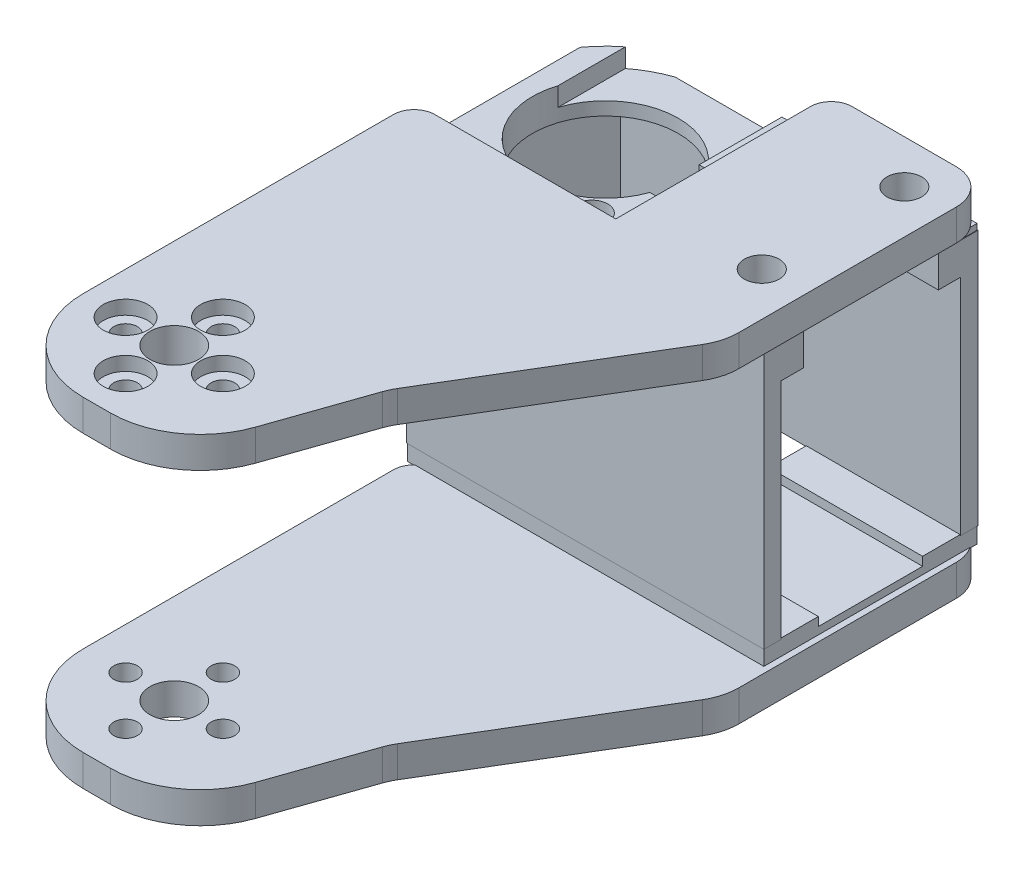
from build123d import *

# Parameters (mm, degrees)
BOSS_1_DEPTH    = 4.5
S_CYL2_R        = 9.5
BOSS_2_DEPTH    = 3.2
BOSS_3_DEPTH    = 4.5
S_BOX4_W        = 2.5
S_BOX4_H        = 36.8
BOSS_4_DEPTH    = 30.8
S_BOX5_W        = 51.4
S_BOX5_H        = 36.8
BOSS_5_DEPTH    = 2.5
S_BOX6_W        = 51.4
S_BOX6_H        = 36.8
BOSS_6_DEPTH    = 2.5
S_BOX7_W        = 51.4
S_BOX7_H        = 4.6
BOSS_7_DEPTH    = 30.8
S_BOX8_W        = 22.13
S_BOX8_H        = 2.4
BOSS_8_DEPTH    = 30.66
S_BOX9_W        = 29.16
S_BOX9_H        = 2.4
BOSS_9_DEPTH    = 1.83
S_BOX10_W       = 22.13
S_BOX10_H       = 0.95
BOSS_10_DEPTH   = 30.66
S_BOX11_W       = 29.16
S_BOX11_H       = 0.95
BOSS_11_DEPTH   = 1.83
S_HOLE12_R      = 3.5
HOLE_12_DEPTH   = 4.7
S_HOLE13_R      = 1.7
HOLE_13_DEPTH   = 4.7
S_HOLE14_R      = 1.7
HOLE_14_DEPTH   = 4.7
S_HOLE15_R      = 1.7
HOLE_15_DEPTH   = 4.7
S_HOLE16_R      = 1.7
HOLE_16_DEPTH   = 4.7
S_HOLE17_R      = 3.2
HOLE_17_DEPTH   = 1.6
S_HOLE18_R      = 3.2
HOLE_18_DEPTH   = 1.6
S_HOLE19_R      = 3.2
HOLE_19_DEPTH   = 1.6
S_HOLE20_R      = 3.2
HOLE_20_DEPTH   = 1.6
S_HOLE21_R      = 3.5
HOLE_21_DEPTH   = 7.9
S_HOLE22_R      = 1.7
HOLE_22_DEPTH   = 7.9
S_HOLE23_R      = 1.7
HOLE_23_DEPTH   = 7.9
S_HOLE24_R      = 1.7
HOLE_24_DEPTH   = 7.9
S_HOLE25_R      = 1.7
HOLE_25_DEPTH   = 7.9
S_HOLE26_R      = 3.2
HOLE_26_DEPTH   = 2.1
S_HOLE27_R      = 3.2
HOLE_27_DEPTH   = 2.1
S_HOLE28_R      = 3.2
HOLE_28_DEPTH   = 2.1
S_HOLE29_R      = 3.2
HOLE_29_DEPTH   = 2.1
S_CUT30_W       = 6.8
S_CUT30_H       = 1
POCKET_30_DEPTH = 10
S_HOLE31_R      = 10.5
HOLE_31_DEPTH   = 4.8
S_CUT32_W       = 19.5
S_CUT32_H       = 4.75
POCKET_32_DEPTH = 19.4
S_CUT33_W       = 8.3
S_CUT33_H       = 4.75
POCKET_33_DEPTH = 19.4
S_CUT34_W       = 11
S_CUT34_H       = 4.75
POCKET_34_DEPTH = 7
S_CUT35_W       = 20
S_CUT35_H       = 2.9
POCKET_35_DEPTH = 15.9
S_HOLE36_R      = 1.1
HOLE_36_DEPTH   = 4.8
S_HOLE37_R      = 2.3
HOLE_37_DEPTH   = 1.7
S_HOLE38_R      = 1.1
HOLE_38_DEPTH   = 4.8
S_HOLE39_R      = 2.3
HOLE_39_DEPTH   = 1.7
S_HOLE40_R      = 1.1
HOLE_40_DEPTH   = 4.8
S_HOLE41_R      = 2.3
HOLE_41_DEPTH   = 1.7
S_CUT42_W       = 30.6
S_CUT42_H       = 1.55
POCKET_42_DEPTH = 15
S_HOLE43_R      = 2.5
HOLE_43_DEPTH   = 5.3
S_HOLE44_R      = 2.5
HOLE_44_DEPTH   = 5.3
CUT_45_DEPTH    = 4.9
CUT_46_DEPTH    = 32


with BuildPart() as part:
    # S_prism1 → Boss_1 (new body)
    with BuildSketch(Plane(origin=(0, -23.3, 0), x_dir=(1, 0, 0), z_dir=(0, 1, 0))):
        with BuildLine():
            Line((-0.1, -13), (3.8289, -13))
            ThreePointArc((3.8289, -13), (11.303548347, -10.613765629), (16.0129, -4.3379))
            Line((16.0129, -4.3379), (20.7288, 9.2202))
            ThreePointArc((20.7288, 9.2202), (21.038506496, 9.982013886), (21.4248, 10.708))
            Line((21.4248, 10.708), (37.8599, 38.0999))
            ThreePointArc((37.8599, 38.0999), (38.709702939, 40.080410611), (39, 42.2159))
            Line((39, 42.2159), (39, 73.5))
            ThreePointArc((39, 73.5), (37.5355, 77.0355), (34, 78.5))
            Line((34, 78.5), (19, 78.5))
            ThreePointArc((19, 78.5), (16.8787, 77.6213), (16, 75.5))
            Line((16, 75.5), (16, 47.5))
            Line((16, 47.5), (-10, 47.5))
            ThreePointArc((-10, 47.5), (-12.1213, 46.6213), (-13, 44.5))
            Line((-13, 44.5), (-13, -0.1))
            ThreePointArc((-13, -0.1), (-9.2217, -9.2217), (-0.1, -13))
        make_face()
    extrude(amount=BOSS_1_DEPTH)



with BuildPart() as body_2:
    # S_cyl2 → Boss_2 (new body)
    with BuildSketch(Plane(origin=(0, 17.75, 0), x_dir=(1, 0, 0), z_dir=(0, 1, 0))):
        Circle(S_CYL2_R)
    extrude(amount=BOSS_2_DEPTH)

    # S_prism3 → Boss_3 (add)
    with BuildSketch(Plane(origin=(0, 20.95, 0), x_dir=(1, 0, 0), z_dir=(0, 1, 0))):
        with BuildLine():
            Line((-0.1, -13), (3.8289, -13))
            ThreePointArc((3.8289, -13), (11.303548347, -10.613765629), (16.0129, -4.3379))
            Line((16.0129, -4.3379), (20.7288, 9.2202))
            ThreePointArc((20.7288, 9.2202), (21.038506496, 9.982013886), (21.4248, 10.708))
            Line((21.4248, 10.708), (37.8599, 38.0999))
            ThreePointArc((37.8599, 38.0999), (38.709702939, 40.080410611), (39, 42.2159))
            Line((39, 42.2159), (39, 73.5))
            ThreePointArc((39, 73.5), (37.5355, 77.0355), (34, 78.5))
            Line((34, 78.5), (19, 78.5))
            ThreePointArc((19, 78.5), (16.8787, 77.6213), (16, 75.5))
            Line((16, 75.5), (16, 47.5))
            Line((16, 47.5), (-10, 47.5))
            ThreePointArc((-10, 47.5), (-12.1213, 46.6213), (-13, 44.5))
            Line((-13, 44.5), (-13, -0.1))
            ThreePointArc((-13, -0.1), (-9.2217, -9.2217), (-0.1, -13))
        make_face()
    extrude(amount=BOSS_3_DEPTH)


with BuildPart() as body_3:
    # S_box4 → Boss_4 (new body)
    with BuildSketch(Plane.XY.offset(-77.4)):
        with Locations((-11.95, 1.8)):
            Rectangle(S_BOX4_W, S_BOX4_H)
    extrude(amount=BOSS_4_DEPTH)

    # S_box5 → Boss_5 (add)
    with BuildSketch(Plane.XY.offset(-77.4)):
        with Locations((12.5, 1.8)):
            Rectangle(S_BOX5_W, S_BOX5_H)
    extrude(amount=BOSS_5_DEPTH)

    # S_box6 → Boss_6 (add)
    with BuildSketch(Plane.XY.offset(-49.1)):
        with Locations((12.5, 1.8)):
            Rectangle(S_BOX6_W, S_BOX6_H)
    extrude(amount=BOSS_6_DEPTH)

    # S_box7 → Boss_7 (add)
    with BuildSketch(Plane.XY.offset(-77.4)):
        with Locations((12.5, 17.9)):
            Rectangle(S_BOX7_W, S_BOX7_H)
    extrude(amount=BOSS_7_DEPTH)


with BuildPart() as part_1:
    add(part.part)

    add(body_3.part)  # Boss_8 merges body 3
    # S_box8 → Boss_8 (add)
    with BuildSketch(Plane.XY.offset(-77.33)):
        with Locations((27.065, -17.7)):
            Rectangle(S_BOX8_W, S_BOX8_H)
    extrude(amount=BOSS_8_DEPTH)

    # S_box9 → Boss_9 (add)
    with BuildSketch(Plane.XY.offset(-48.5)):
        with Locations((1.45, -17.7)):
            Rectangle(S_BOX9_W, S_BOX9_H)
    extrude(amount=BOSS_9_DEPTH)


    add(body_2.part)  # Boss_10 merges body 2
    # S_box10 → Boss_10 (add)
    with BuildSketch(Plane.XY.offset(-77.33)):
        with Locations((27.065, 20.575)):
            Rectangle(S_BOX10_W, S_BOX10_H)
    extrude(amount=BOSS_10_DEPTH)

    # S_box11 → Boss_11 (add)
    with BuildSketch(Plane.XY.offset(-48.5)):
        with Locations((1.45, 20.575)):
            Rectangle(S_BOX11_W, S_BOX11_H)
    extrude(amount=BOSS_11_DEPTH)

    # S_hole12 → Hole_12 (cut)
    with BuildSketch(Plane(origin=(0, -23.4, 0), x_dir=(1, 0, 0), z_dir=(0, 1, 0))):
        Circle(S_HOLE12_R)
    extrude(amount=HOLE_12_DEPTH, mode=Mode.SUBTRACT)

    # S_hole13 → Hole_13 (cut)
    with BuildSketch(Plane(origin=(0, -23.4, 0), x_dir=(1, 0, 0), z_dir=(0, 1, 0))):
        with Locations((7, 0)):
            Circle(S_HOLE13_R)
    extrude(amount=HOLE_13_DEPTH, mode=Mode.SUBTRACT)

    # S_hole14 → Hole_14 (cut)
    with BuildSketch(Plane(origin=(0, -23.4, 0), x_dir=(1, 0, 0), z_dir=(0, 1, 0))):
        with Locations((0, -7)):
            Circle(S_HOLE14_R)
    extrude(amount=HOLE_14_DEPTH, mode=Mode.SUBTRACT)

    # S_hole15 → Hole_15 (cut)
    with BuildSketch(Plane(origin=(0, -23.4, 0), x_dir=(1, 0, 0), z_dir=(0, 1, 0))):
        with Locations((-7, 0)):
            Circle(S_HOLE15_R)
    extrude(amount=HOLE_15_DEPTH, mode=Mode.SUBTRACT)

    # S_hole16 → Hole_16 (cut)
    with BuildSketch(Plane(origin=(0, -23.4, 0), x_dir=(1, 0, 0), z_dir=(0, 1, 0))):
        with Locations((0, 7)):
            Circle(S_HOLE16_R)
    extrude(amount=HOLE_16_DEPTH, mode=Mode.SUBTRACT)

    # S_hole17 → Hole_17 (cut)
    with BuildSketch(Plane(origin=(0, -23.4, 0), x_dir=(1, 0, 0), z_dir=(0, 1, 0))):
        with Locations((7, 0)):
            Circle(S_HOLE17_R)
    extrude(amount=HOLE_17_DEPTH, mode=Mode.SUBTRACT)

    # S_hole18 → Hole_18 (cut)
    with BuildSketch(Plane(origin=(0, -23.4, 0), x_dir=(1, 0, 0), z_dir=(0, 1, 0))):
        with Locations((0, -7)):
            Circle(S_HOLE18_R)
    extrude(amount=HOLE_18_DEPTH, mode=Mode.SUBTRACT)

    # S_hole19 → Hole_19 (cut)
    with BuildSketch(Plane(origin=(0, -23.4, 0), x_dir=(1, 0, 0), z_dir=(0, 1, 0))):
        with Locations((-7, 0)):
            Circle(S_HOLE19_R)
    extrude(amount=HOLE_19_DEPTH, mode=Mode.SUBTRACT)

    # S_hole20 → Hole_20 (cut)
    with BuildSketch(Plane(origin=(0, -23.4, 0), x_dir=(1, 0, 0), z_dir=(0, 1, 0))):
        with Locations((0, 7)):
            Circle(S_HOLE20_R)
    extrude(amount=HOLE_20_DEPTH, mode=Mode.SUBTRACT)

    # S_hole21 → Hole_21 (cut)
    with BuildSketch(Plane(origin=(0, 17.65, 0), x_dir=(1, 0, 0), z_dir=(0, 1, 0))):
        Circle(S_HOLE21_R)
    extrude(amount=HOLE_21_DEPTH, mode=Mode.SUBTRACT)

    # S_hole22 → Hole_22 (cut)
    with BuildSketch(Plane(origin=(0, 17.65, 0), x_dir=(1, 0, 0), z_dir=(0, 1, 0))):
        with Locations((7, 0)):
            Circle(S_HOLE22_R)
    extrude(amount=HOLE_22_DEPTH, mode=Mode.SUBTRACT)

    # S_hole23 → Hole_23 (cut)
    with BuildSketch(Plane(origin=(0, 17.65, 0), x_dir=(1, 0, 0), z_dir=(0, 1, 0))):
        with Locations((0, -7)):
            Circle(S_HOLE23_R)
    extrude(amount=HOLE_23_DEPTH, mode=Mode.SUBTRACT)

    # S_hole24 → Hole_24 (cut)
    with BuildSketch(Plane(origin=(0, 17.65, 0), x_dir=(1, 0, 0), z_dir=(0, 1, 0))):
        with Locations((-7, 0)):
            Circle(S_HOLE24_R)
    extrude(amount=HOLE_24_DEPTH, mode=Mode.SUBTRACT)

    # S_hole25 → Hole_25 (cut)
    with BuildSketch(Plane(origin=(0, 17.65, 0), x_dir=(1, 0, 0), z_dir=(0, 1, 0))):
        with Locations((0, 7)):
            Circle(S_HOLE25_R)
    extrude(amount=HOLE_25_DEPTH, mode=Mode.SUBTRACT)

    # S_hole26 → Hole_26 (cut)
    with BuildSketch(Plane(origin=(0, 23.45, 0), x_dir=(1, 0, 0), z_dir=(0, 1, 0))):
        with Locations((7, 0)):
            Circle(S_HOLE26_R)
    extrude(amount=HOLE_26_DEPTH, mode=Mode.SUBTRACT)

    # S_hole27 → Hole_27 (cut)
    with BuildSketch(Plane(origin=(0, 23.45, 0), x_dir=(1, 0, 0), z_dir=(0, 1, 0))):
        with Locations((0, -7)):
            Circle(S_HOLE27_R)
    extrude(amount=HOLE_27_DEPTH, mode=Mode.SUBTRACT)

    # S_hole28 → Hole_28 (cut)
    with BuildSketch(Plane(origin=(0, 23.45, 0), x_dir=(1, 0, 0), z_dir=(0, 1, 0))):
        with Locations((-7, 0)):
            Circle(S_HOLE28_R)
    extrude(amount=HOLE_28_DEPTH, mode=Mode.SUBTRACT)

    # S_hole29 → Hole_29 (cut)
    with BuildSketch(Plane(origin=(0, 23.45, 0), x_dir=(1, 0, 0), z_dir=(0, 1, 0))):
        with Locations((0, 7)):
            Circle(S_HOLE29_R)
    extrude(amount=HOLE_29_DEPTH, mode=Mode.SUBTRACT)

    # S_cut30 → Pocket_30 (cut)
    with BuildSketch(Plane.XY):
        with Locations((0, 18.15)):
            Rectangle(S_CUT30_W, S_CUT30_H)
    extrude(amount=POCKET_30_DEPTH, mode=Mode.SUBTRACT)

    # S_hole31 → Hole_31 (cut)
    with BuildSketch(Plane(origin=(0, 15.5, 0), x_dir=(1, 0, 0), z_dir=(0, 1, 0))):
        with Locations((0, 62)):
            Circle(S_HOLE31_R)
    extrude(amount=HOLE_31_DEPTH, mode=Mode.SUBTRACT)

    # S_cut32 → Pocket_32 (cut)
    with BuildSketch(Plane.XY.offset(-71.7)):
        with Locations((20.65, 17.925)):
            Rectangle(S_CUT32_W, S_CUT32_H)
    extrude(amount=POCKET_32_DEPTH, mode=Mode.SUBTRACT)

    # S_cut33 → Pocket_33 (cut)
    with BuildSketch(Plane.XY.offset(-71.7)):
        with Locations((34.55, 17.925)):
            Rectangle(S_CUT33_W, S_CUT33_H)
    extrude(amount=POCKET_33_DEPTH, mode=Mode.SUBTRACT)

    # S_cut34 → Pocket_34 (cut)
    with BuildSketch(Plane.XY.offset(-65.5)):
        with Locations((5.5, 17.925)):
            Rectangle(S_CUT34_W, S_CUT34_H)
    extrude(amount=POCKET_34_DEPTH, mode=Mode.SUBTRACT)

    # S_cut35 → Pocket_35 (cut)
    with BuildSketch(Plane.XY.offset(-77.9)):
        with Locations((0, 18.95)):
            Rectangle(S_CUT35_W, S_CUT35_H)
    extrude(amount=POCKET_35_DEPTH, mode=Mode.SUBTRACT)

    # S_hole36 → Hole_36 (cut)
    with BuildSketch(Plane(origin=(0, 15.5, 0), x_dir=(1, 0, 0), z_dir=(0, 1, 0))):
        with Locations((8.3, 51.75)):
            Circle(S_HOLE36_R)
    extrude(amount=HOLE_36_DEPTH, mode=Mode.SUBTRACT)

    # S_hole37 → Hole_37 (cut)
    with BuildSketch(Plane(origin=(0, 18.6, 0), x_dir=(1, 0, 0), z_dir=(0, 1, 0))):
        with Locations((8.3, 51.75)):
            Circle(S_HOLE37_R)
    extrude(amount=HOLE_37_DEPTH, mode=Mode.SUBTRACT)

    # S_hole38 → Hole_38 (cut)
    with BuildSketch(Plane(origin=(0, 15.5, 0), x_dir=(1, 0, 0), z_dir=(0, 1, 0))):
        with Locations((32.75, 72.25)):
            Circle(S_HOLE38_R)
    extrude(amount=HOLE_38_DEPTH, mode=Mode.SUBTRACT)

    # S_hole39 → Hole_39 (cut)
    with BuildSketch(Plane(origin=(0, 18.6, 0), x_dir=(1, 0, 0), z_dir=(0, 1, 0))):
        with Locations((32.75, 72.25)):
            Circle(S_HOLE39_R)
    extrude(amount=HOLE_39_DEPTH, mode=Mode.SUBTRACT)

    # S_hole40 → Hole_40 (cut)
    with BuildSketch(Plane(origin=(0, 15.5, 0), x_dir=(1, 0, 0), z_dir=(0, 1, 0))):
        with Locations((32.75, 51.75)):
            Circle(S_HOLE40_R)
    extrude(amount=HOLE_40_DEPTH, mode=Mode.SUBTRACT)

    # S_hole41 → Hole_41 (cut)
    with BuildSketch(Plane(origin=(0, 18.6, 0), x_dir=(1, 0, 0), z_dir=(0, 1, 0))):
        with Locations((32.75, 51.75)):
            Circle(S_HOLE41_R)
    extrude(amount=HOLE_41_DEPTH, mode=Mode.SUBTRACT)

    # S_cut42 → Pocket_42 (cut)
    with BuildSketch(Plane.XY.offset(-69.5)):
        with Locations((23.4, -16.975)):
            Rectangle(S_CUT42_W, S_CUT42_H)
    extrude(amount=POCKET_42_DEPTH, mode=Mode.SUBTRACT)

    # S_hole43 → Hole_43 (cut)
    with BuildSketch(Plane(origin=(0, 20.25, 0), x_dir=(1, 0, 0), z_dir=(0, 1, 0))):
        with Locations((32.75, 72.25)):
            Circle(S_HOLE43_R)
    extrude(amount=HOLE_43_DEPTH, mode=Mode.SUBTRACT)

    # S_hole44 → Hole_44 (cut)
    with BuildSketch(Plane(origin=(0, 20.25, 0), x_dir=(1, 0, 0), z_dir=(0, 1, 0))):
        with Locations((32.75, 51.75)):
            Circle(S_HOLE44_R)
    extrude(amount=HOLE_44_DEPTH, mode=Mode.SUBTRACT)

    # S_pcut45 → Cut_45 (cut)
    with BuildSketch(Plane(origin=(0, 15.5, 0), x_dir=(1, 0, 0), z_dir=(0, 1, 0))):
        with BuildLine():
            Line((0.5, 78.308), (0.5, 82))
            Line((0.5, 82), (-20, 82))
            Line((-20, 82), (-20, 62))
            Line((-20, 62), (-16.3, 62))
            ThreePointArc((-16.3, 62), (-11.34548413, 73.703431775), (0.5, 78.308))
        make_face()
    extrude(amount=CUT_45_DEPTH, mode=Mode.SUBTRACT)

    # S_pcut46 → Cut_46 (cut)
    with BuildSketch(Plane(origin=(0, -16.4, 0), x_dir=(1, 0, 0), z_dir=(0, 1, 0))):
        with BuildLine():
            Line((0.5, 80.508), (0.5, 82))
            Line((0.5, 82), (-20, 82))
            Line((-20, 82), (-20, 62))
            Line((-20, 62), (-18.5, 62))
            ThreePointArc((-18.5, 62), (-12.901369895, 75.259080398), (0.5, 80.508))
        make_face()
    extrude(amount=CUT_46_DEPTH, mode=Mode.SUBTRACT)


solid = part_1.part
